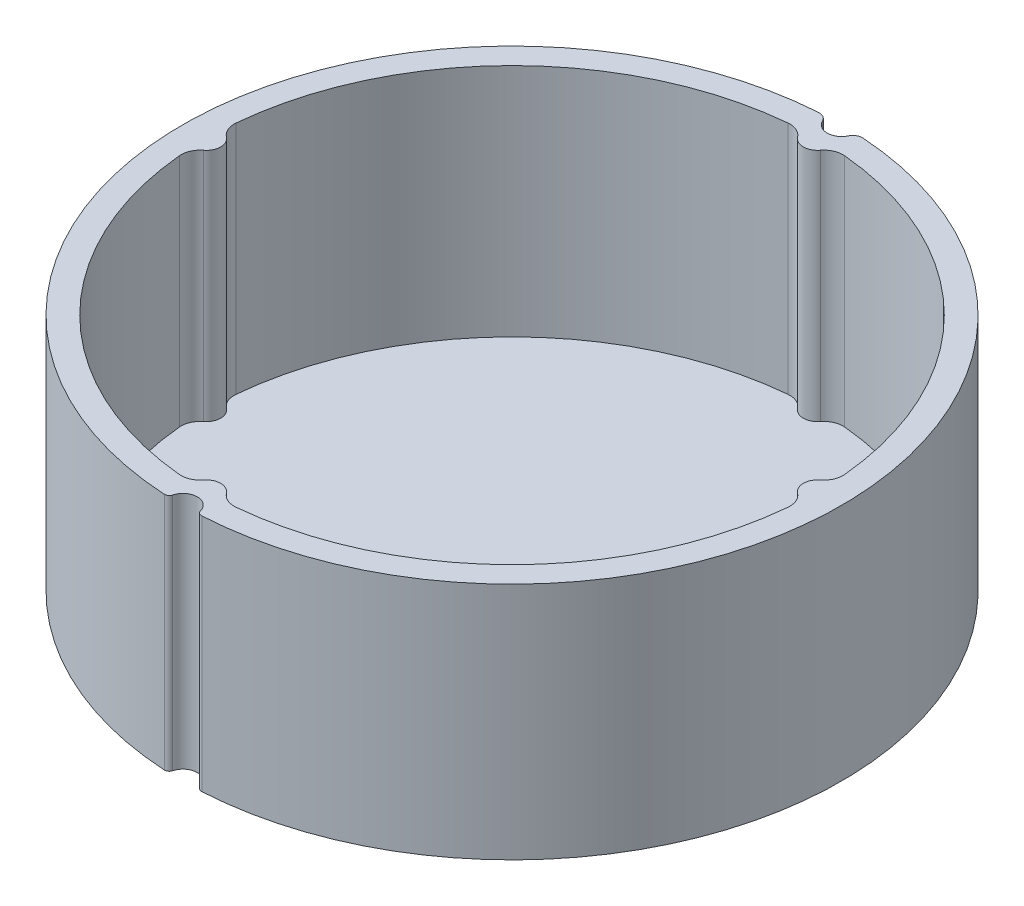
from build123d import *

# Parameters (mm, degrees)
BOSS_EXTRUDE1_DEPTH = 25
CUT_EXTRUDE2_DEPTH  = 55.786493398
BOSS_EXTRUDE2_DEPTH = 0.4


with BuildPart() as part:
    # Sketch1 → Boss-Extrude1 (new body)
    with BuildSketch(Plane(origin=(0, 0, 0), x_dir=(1, 0, 0), z_dir=(0, 1, 0))):
        with BuildLine():
            ThreePointArc((1.451818925, -34.068556857), (1.641248992, -34.346908706), (1.964225605, -34.442038138))
            ThreePointArc((1.964225605, -34.442038138), (26.591847487, -21.978073076), (34.198225299, 4.555174015))
            ThreePointArc((34.198225299, 4.555174015), (23.590291339, 25.176355888), (2.324135821, 34.423627607))
            ThreePointArc((2.324135821, 34.423627607), (1.751838249, 34.289058819), (1.354061739, 33.856153382))
            ThreePointArc((1.354061739, 33.856153382), (0, 33.001534515), (-1.354061739, 33.856153382))
            ThreePointArc((-1.354061739, 33.856153382), (-1.751838249, 34.289058819), (-2.324135821, 34.423627607))
            ThreePointArc((-2.324135821, 34.423627607), (-23.590291339, 25.176355888), (-34.198225299, 4.555174015))
            ThreePointArc((-34.198225299, 4.555174015), (-26.591847487, -21.978073076), (-1.964225605, -34.442038138))
            ThreePointArc((-1.964225605, -34.442038138), (-1.641248992, -34.346908706), (-1.451818925, -34.068556857))
            ThreePointArc((-1.451818925, -34.068556857), (0, -32.945679925), (1.451818925, -34.068556857))
        make_face()
        with BuildLine():
            Line((-2.417, 3.787737139), (0, 3.787737139))
            Line((0, 3.787737139), (2.417, 3.787737139))
            ThreePointArc((2.417, 3.787737139), (0, -4.489512172), (-2.417, 3.787737139))
        make_face(mode=Mode.SUBTRACT)
    extrude(amount=BOSS_EXTRUDE1_DEPTH)

    # Sketch2 → Cut-Extrude2 (cut, through all)
    with BuildSketch(Plane(origin=(0, 0, 0), x_dir=(1, 0, 0), z_dir=(0, 1, 0))):
        with BuildLine():
            ThreePointArc((-31.8625, -2.963291034), (-22.627416998, -22.627416998), (-2.963291034, -31.8625))
            ThreePointArc((-2.963291034, -31.8625), (-1.977020771, -31.703659042), (-1.190608005, -31.087611607))
            ThreePointArc((-1.190608005, -31.087611607), (0, -30.5), (1.190608005, -31.087611607))
            ThreePointArc((1.190608005, -31.087611607), (1.977020771, -31.703659042), (2.963291034, -31.8625))
            ThreePointArc((2.963291034, -31.8625), (22.627416998, -22.627416998), (31.8625, -2.963291034))
            ThreePointArc((31.8625, -2.963291034), (31.703659042, -1.977020771), (31.087611607, -1.190608005))
            ThreePointArc((31.087611607, -1.190608005), (30.5, 0), (31.087611607, 1.190608005))
            ThreePointArc((31.087611607, 1.190608005), (31.703659042, 1.977020771), (31.8625, 2.963291034))
            ThreePointArc((31.8625, 2.963291034), (22.627416998, 22.627416998), (2.963291034, 31.8625))
            ThreePointArc((2.963291034, 31.8625), (1.977020771, 31.703659042), (1.190608005, 31.087611607))
            ThreePointArc((1.190608005, 31.087611607), (0, 30.5), (-1.190608005, 31.087611607))
            ThreePointArc((-1.190608005, 31.087611607), (-1.977020771, 31.703659042), (-2.963291034, 31.8625))
            ThreePointArc((-2.963291034, 31.8625), (-22.627416998, 22.627416998), (-31.8625, 2.963291034))
            ThreePointArc((-31.8625, 2.963291034), (-31.703659042, 1.977020771), (-31.087611607, 1.190608005))
            ThreePointArc((-31.087611607, 1.190608005), (-30.5, 0), (-31.087611607, -1.190608005))
            ThreePointArc((-31.087611607, -1.190608005), (-31.703659042, -1.977020771), (-31.8625, -2.963291034))
        make_face()
    extrude(amount=CUT_EXTRUDE2_DEPTH, mode=Mode.SUBTRACT)

    # Sketch2<2> → Boss-Extrude2 (add)
    with BuildSketch(Plane(origin=(0, 0, 0), x_dir=(1, 0, 0), z_dir=(0, 1, 0))):
        with BuildLine():
            ThreePointArc((-31.8625, -2.963291034), (-22.627416998, -22.627416998), (-2.963291034, -31.8625))
            ThreePointArc((-2.963291034, -31.8625), (-1.977020771, -31.703659042), (-1.190608005, -31.087611607))
            ThreePointArc((-1.190608005, -31.087611607), (0, -30.5), (1.190608005, -31.087611607))
            ThreePointArc((1.190608005, -31.087611607), (1.977020771, -31.703659042), (2.963291034, -31.8625))
            ThreePointArc((2.963291034, -31.8625), (22.627416998, -22.627416998), (31.8625, -2.963291034))
            ThreePointArc((31.8625, -2.963291034), (31.703659042, -1.977020771), (31.087611607, -1.190608005))
            ThreePointArc((31.087611607, -1.190608005), (30.5, 0), (31.087611607, 1.190608005))
            ThreePointArc((31.087611607, 1.190608005), (31.703659042, 1.977020771), (31.8625, 2.963291034))
            ThreePointArc((31.8625, 2.963291034), (22.627416998, 22.627416998), (2.963291034, 31.8625))
            ThreePointArc((2.963291034, 31.8625), (1.977020771, 31.703659042), (1.190608005, 31.087611607))
            ThreePointArc((1.190608005, 31.087611607), (0, 30.5), (-1.190608005, 31.087611607))
            ThreePointArc((-1.190608005, 31.087611607), (-1.977020771, 31.703659042), (-2.963291034, 31.8625))
            ThreePointArc((-2.963291034, 31.8625), (-22.627416998, 22.627416998), (-31.8625, 2.963291034))
            ThreePointArc((-31.8625, 2.963291034), (-31.703659042, 1.977020771), (-31.087611607, 1.190608005))
            ThreePointArc((-31.087611607, 1.190608005), (-30.5, 0), (-31.087611607, -1.190608005))
            ThreePointArc((-31.087611607, -1.190608005), (-31.703659042, -1.977020771), (-31.8625, -2.963291034))
        make_face()
    extrude(amount=BOSS_EXTRUDE2_DEPTH)


solid = part.part
